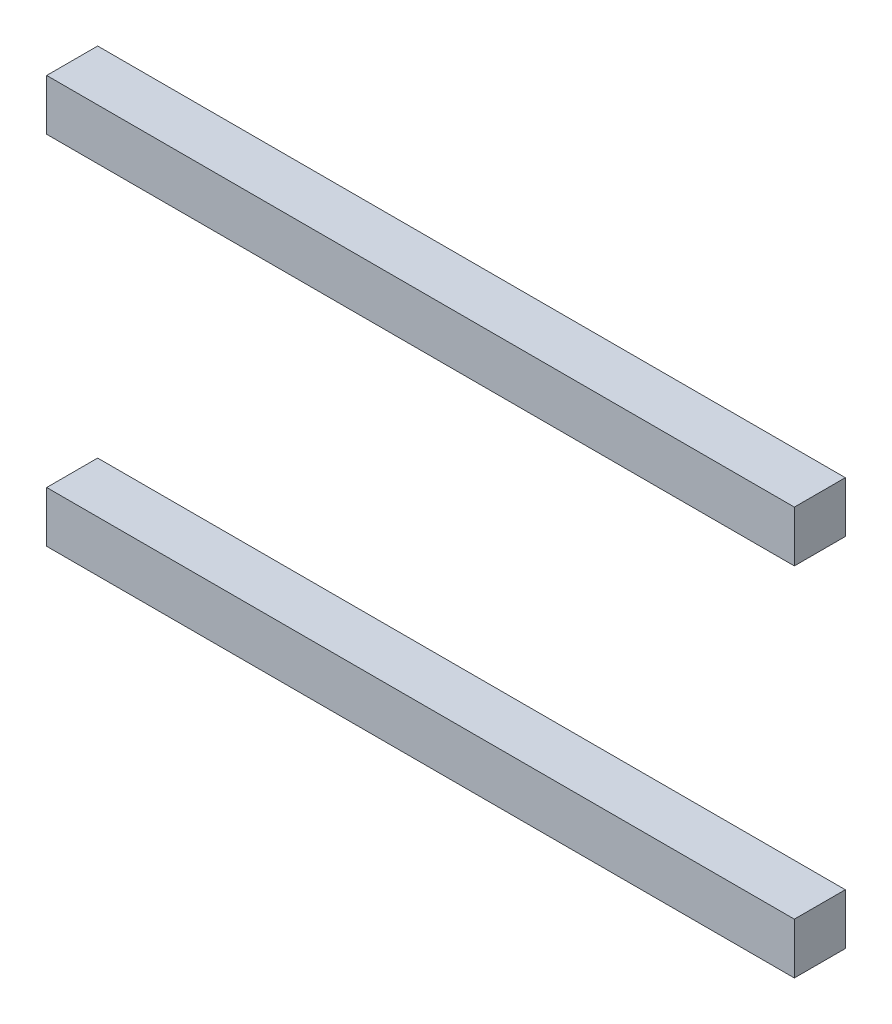
from build123d import *

# Parameters (mm, degrees)
SKETCH_1_W        = 440
SKETCH_1_H        = 30
EXTRUDE_1_DEPTH   = 30
EXTRUDE_1_2_DEPTH = 30


with BuildPart() as part:
    # 草图1 → 凸台-拉伸1 (new body)
    with BuildSketch(Plane.XY):
        with Locations((54.391891892, 77.364864865)):
            Rectangle(SKETCH_1_W, SKETCH_1_H)
    extrude(amount=EXTRUDE_1_DEPTH)


with BuildPart() as body_2:
    # 草图1 → Extrude 1 2 (new body)
    with BuildSketch(Plane.XY):
        with Locations((54.391891892, -132.635135135)):
            Rectangle(SKETCH_1_W, SKETCH_1_H)
    extrude(amount=EXTRUDE_1_2_DEPTH)


solid = Compound([part.part, body_2.part])
